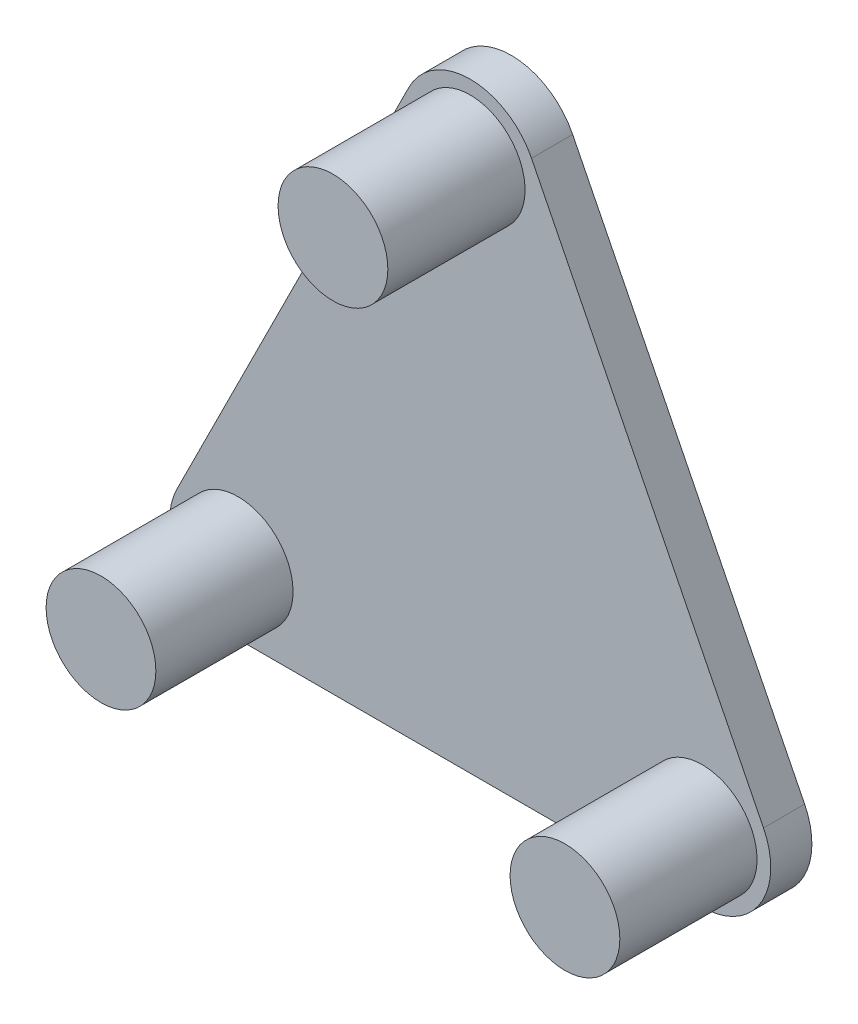
from build123d import *

# Parameters (mm, degrees)
SALIENTE_EXTRUIR1_DEPTH = 3
CROQUIS2_R              = 4
SALIENTE_EXTRUIR2_DEPTH = 10


with BuildPart() as part:
    # Croquis1 → Saliente-Extruir1 (new body)
    with BuildSketch(Plane.XY):
        with BuildLine():
            Line((-27.272909543, -17.135189149), (6.546750569, -17.135189149))
            ThreePointArc((6.546750569, -17.135189149), (10.800004611, -14.76384471), (11.018886524, -9.899121172))
            Line((11.018886524, -9.899121172), (-5.890943532, 23.920538941))
            ThreePointArc((-5.890943532, 23.920538941), (-10.363079487, 26.684470963), (-14.835215442, 23.920538941))
            Line((-14.835215442, 23.920538941), (-31.745045498, -9.899121172))
            ThreePointArc((-31.745045498, -9.899121172), (-31.526163585, -14.76384471), (-27.272909543, -17.135189149))
        make_face()
    extrude(amount=SALIENTE_EXTRUIR1_DEPTH)

    # Croquis2 → Saliente-Extruir2 (add)
    with BuildSketch(Plane.XY.offset(3)):
        with Locations(Location((-10.363079487, 21.684470963, 0), (0, 0, 180))):
            Circle(CROQUIS2_R)
        with Locations(Location((-27.272909543, -12.135189149, 0), (0, 0, 180))):
            Circle(CROQUIS2_R)
        with Locations(Location((6.546750569, -12.135189149, 0), (0, 0, 180))):
            Circle(CROQUIS2_R)
    extrude(amount=SALIENTE_EXTRUIR2_DEPTH)


solid = part.part
